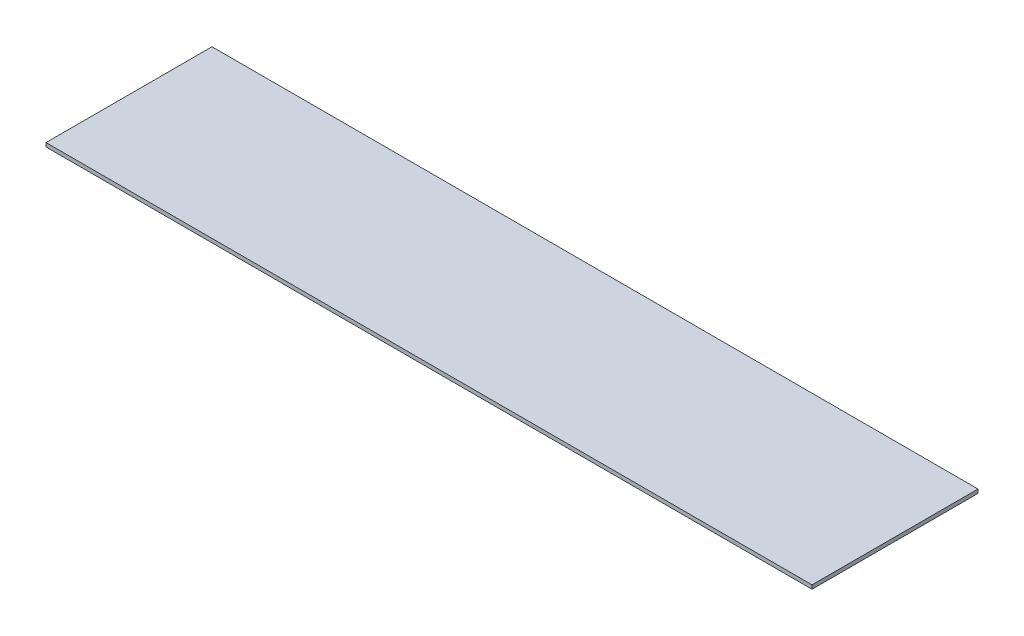
from build123d import *

# Parameters (mm, degrees)
ESBO_O1_W                = 300
ESBO_O1_H                = 65
RESSALTO_EXTRUS_O1_DEPTH = 1.5


with BuildPart() as part:
    # Esboço1 → Ressalto-extrusão1 (new body)
    with BuildSketch(Plane(origin=(0, 0, 0), x_dir=(1, 0, 0), z_dir=(0, 1, 0))):
        with Locations((150, 32.5)):
            Rectangle(ESBO_O1_W, ESBO_O1_H)
    extrude(amount=RESSALTO_EXTRUS_O1_DEPTH)


solid = part.part
